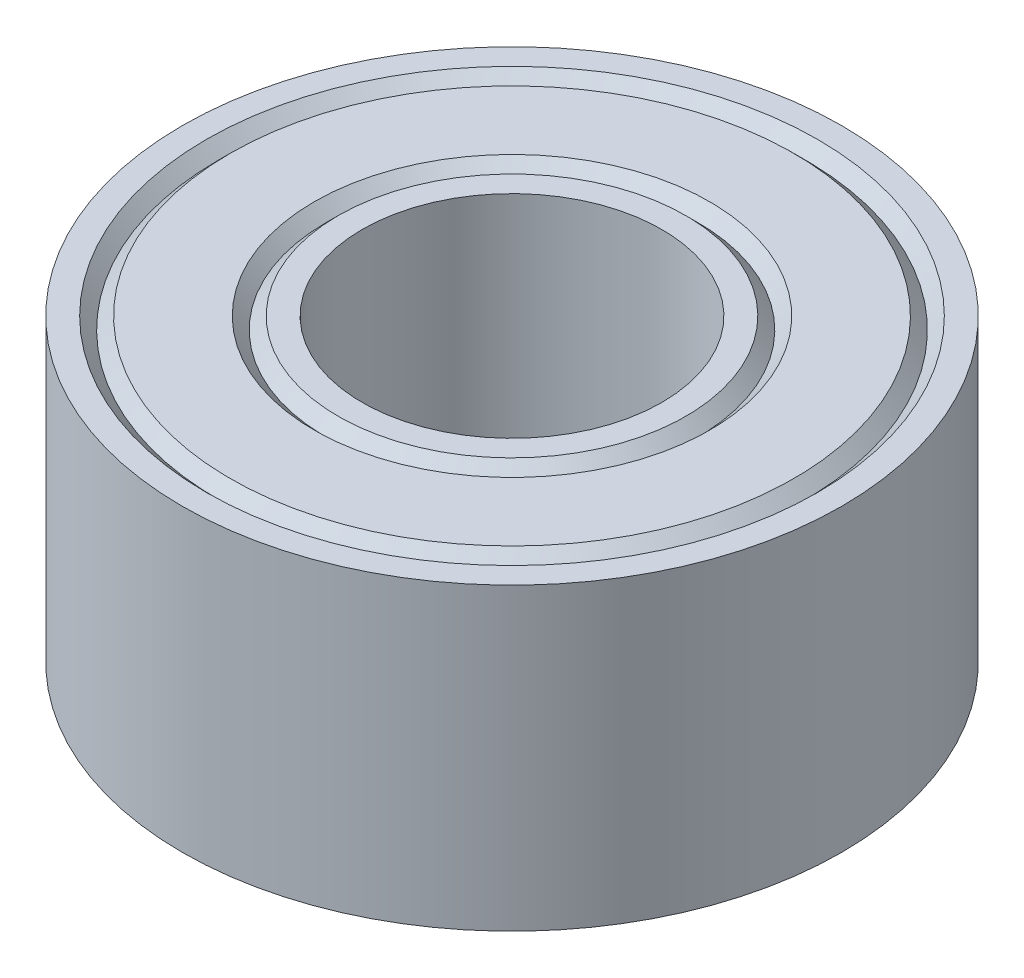
from build123d import *


with BuildPart() as part:
    # Sketch1 → Revolve1 (revolve)
    with BuildSketch(Plane.XY):
        Polygon((-2.5, 2.5), (-2.9, 2.5), (-3.1, 2.3), (-3.3, 2.5), (-4.7, 2.5), (-4.9, 2.3), (-5.1, 2.5), (-5.5, 2.5), (-5.5, -2.5), (-5.1, -2.5), (-4.9, -2.3), (-4.7, -2.5), (-3.3, -2.5), (-3.1, -2.3), (-2.9, -2.5), (-2.5, -2.5), align=None)
    revolve(axis=Axis((0, 2.5, 0), (0, -1, 0)))


solid = part.part
